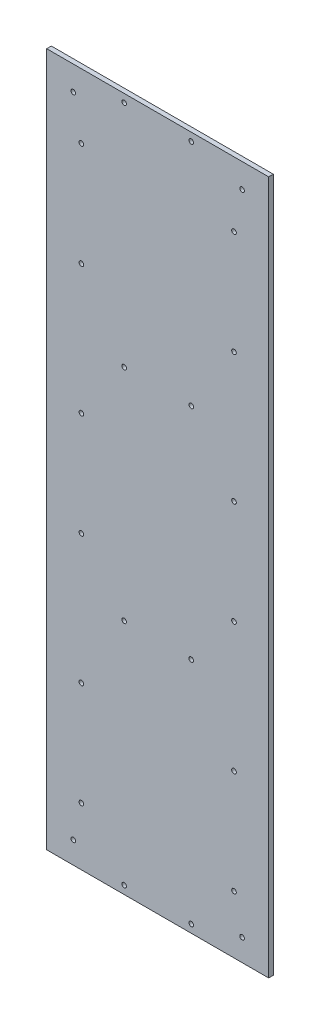
from build123d import *

# Parameters (mm, degrees)
SKETCH1_W           = 96
SKETCH1_H           = 300
BOSS_EXTRUDE1_DEPTH = 2
SKETCH2_R           = 1
CUT_EXTRUDE1_DEPTH  = 10
SKETCH3_R           = 1
CUT_EXTRUDE2_DEPTH  = 10


with BuildPart() as part:
    # Sketch1 → Boss-Extrude1 (new body)
    with BuildSketch(Plane.XY):
        Rectangle(SKETCH1_W, SKETCH1_H)
    extrude(amount=BOSS_EXTRUDE1_DEPTH)

    # Sketch2 → Cut-Extrude1 (cut)
    with BuildSketch(Plane.XY.offset(2)):
        with Locations((-33, 122)):
            Circle(SKETCH2_R)
        with Locations((-33, 77)):
            Circle(SKETCH2_R)
        with Locations((-33, -125)):
            Circle(SKETCH2_R)
        with Locations((14.5, -146.5)):
            Circle(SKETCH2_R)
        with Locations((-14.5, -146.5)):
            Circle(SKETCH2_R)
        with Locations((-14.5, -47.5)):
            Circle(SKETCH2_R)
        with Locations((-14.5, 47.5)):
            Circle(SKETCH2_R)
        with Locations((-14.5, 146.5)):
            Circle(SKETCH2_R)
        with Locations((14.5, 146.5)):
            Circle(SKETCH2_R)
        with Locations((-33, -80)):
            Circle(SKETCH2_R)
        with Locations((-33, -24)):
            Circle(SKETCH2_R)
        with Locations((-33, 21)):
            Circle(SKETCH2_R)
        with Locations((33, 21)):
            Circle(SKETCH2_R)
        with Locations((33, -24)):
            Circle(SKETCH2_R)
        with Locations((33, -80)):
            Circle(SKETCH2_R)
        with Locations((33, -125)):
            Circle(SKETCH2_R)
        with Locations((33, 77)):
            Circle(SKETCH2_R)
        with Locations((33, 122)):
            Circle(SKETCH2_R)
        with Locations((14.5, -47.5)):
            Circle(SKETCH2_R)
        with Locations((14.5, 47.5)):
            Circle(SKETCH2_R)
    extrude(amount=-CUT_EXTRUDE1_DEPTH, mode=Mode.SUBTRACT)

    # Sketch3 → Cut-Extrude2 (cut)
    with BuildSketch(Plane.XY.offset(2)):
        with Locations((-36.5, 139.5)):
            Circle(SKETCH3_R)
        with Locations((36.5, 139.5)):
            Circle(SKETCH3_R)
        with Locations((-36.5, -140.5)):
            Circle(SKETCH3_R)
        with Locations((36.5, -140.5)):
            Circle(SKETCH3_R)
    extrude(amount=-CUT_EXTRUDE2_DEPTH, mode=Mode.SUBTRACT)


solid = part.part
